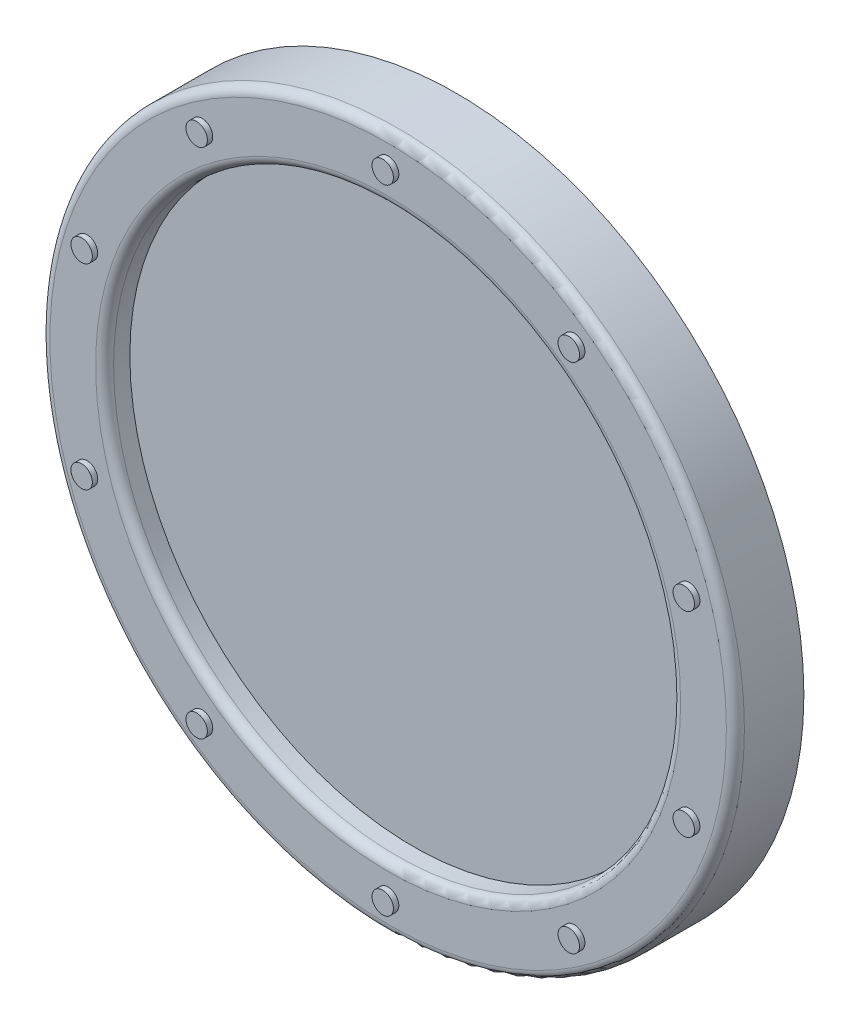
from build123d import *

# Parameters (mm, degrees)
SKETCH1_R           = 385.386266527
SKETCH1_R_2         = 314.620020727
BOSS_EXTRUDE1_DEPTH = 76
SKETCH2_R           = 342.381897502
BOSS_EXTRUDE2_DEPTH = 48
FILLET2_R           = 10
FILLET3_R           = 10
SKETCH3_R           = 11.890150021
BOSS_EXTRUDE3_DEPTH = 6


with BuildPart() as part:
    # Sketch1 → Boss-Extrude1 (new body)
    with BuildSketch(Plane.XY):
        with Locations((-180.105067614, 94.800611997)):
            Circle(SKETCH1_R)
        with Locations((-180.105067614, 94.800611997)):
            Circle(SKETCH1_R_2, mode=Mode.SUBTRACT)
    extrude(amount=-BOSS_EXTRUDE1_DEPTH)

    # Fillet2
    fillet2_edges = [part.edges().sort_by_distance(p)[0] for p in [
        (-494.725088342, 94.800611997, 0),
    ]]
    fillet(fillet2_edges, radius=FILLET2_R)

    # Fillet3
    fillet3_edges = [part.edges().sort_by_distance(p)[0] for p in [
        (-565.491334141, 94.800611997, 0),
    ]]
    fillet(fillet3_edges, radius=FILLET3_R)

    # Sketch3 → Boss-Extrude3 (add)
    with BuildSketch(Plane.XY):
        with Locations((26.383251483, 379.007401192)):
            Circle(SKETCH3_R)
        with Locations((-180.105067614, 446.099523109)):
            Circle(SKETCH3_R)
        with Locations((154.000050965, 203.357945636)):
            Circle(SKETCH3_R)
        with Locations((154.000050965, -13.756721642)):
            Circle(SKETCH3_R)
        with Locations((26.383251483, -189.406177197)):
            Circle(SKETCH3_R)
        with Locations((-180.105067614, -256.498299114)):
            Circle(SKETCH3_R)
        with Locations((-386.593386712, -189.406177197)):
            Circle(SKETCH3_R)
        with Locations((-514.210186194, -13.756721642)):
            Circle(SKETCH3_R)
        with Locations((-514.210186194, 203.357945636)):
            Circle(SKETCH3_R)
        with Locations((-386.593386712, 379.007401192)):
            Circle(SKETCH3_R)
    extrude(amount=BOSS_EXTRUDE3_DEPTH)


with BuildPart() as body_2:
    # Sketch2 → Boss-Extrude2 (new body)
    with BuildSketch(Plane(origin=(0, 0, -76), x_dir=(-1, 0, 0), z_dir=(0, 0, -1))):
        with Locations((180.105067614, 94.800611997)):
            Circle(SKETCH2_R)
    extrude(amount=-BOSS_EXTRUDE2_DEPTH)


solid = Compound([part.part, body_2.part])
